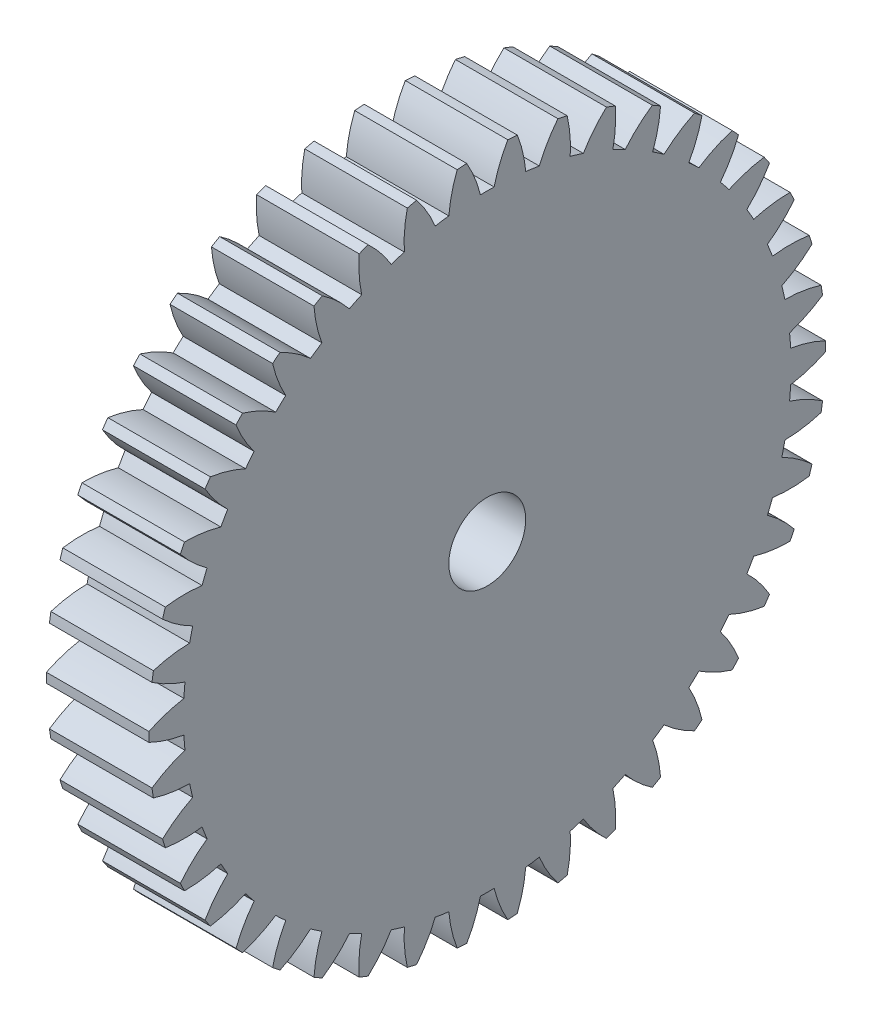
from build123d import *

# Parameters (mm, degrees)
BASPROSKE_W     = 4
BASPROSKE_H     = 13.2
TOOTHCUT_DEPTH  = 20.091359302
TEETHCUTS_COUNT = 42
TEETHCUTS_ANGLE = 351.428571429
BORSKE_R        = 1.5
BORE_DEPTH      = 50.0000508


with BuildPart() as part:
    # BasProSke → Base-Revolve (revolve)
    with BuildSketch(Plane(origin=(0, 0, 0), x_dir=(1, 0, 0), z_dir=(0, 1, 0)), mode=Mode.PRIVATE) as base_revolve_sk:
        with Locations((2, 6.6)):
            Rectangle(BASPROSKE_W, BASPROSKE_H)
    revolve(base_revolve_sk.sketch.rotate(Axis((-10, 0, 0), (1, 0, 0)), 180), axis=Axis((-10, 0, 0), (1, 0, 0)))

    # TooCutSke → ToothCut (cut, through all)
    with BuildSketch(Plane(origin=(0, 0, 0), x_dir=(0, 0, -1), z_dir=(1, 0, 0))):
        with BuildLine():
            ThreePointArc((0.267879645, 11.84597153), (0, 11.849), (-0.267879645, 11.84597153))
            ThreePointArc((-0.267879645, 11.84597153), (-0.492277047, 12.543046301), (-0.81532182, 13.200244524))
            ThreePointArc((-0.81532182, 13.200244524), (0, 13.2254), (0.81532182, 13.200244524))
            ThreePointArc((0.81532182, 13.200244524), (0.492277047, 12.543046301), (0.267879645, 11.84597153))
        make_face()
    toothcut = extrude(amount=TOOTHCUT_DEPTH, mode=Mode.SUBTRACT)

    # TeethCuts: ToothCut ×42 about axis
    teethcuts_axis = Axis((-10, 0, 0), (1, 0, 0))
    for i in range(1, TEETHCUTS_COUNT):
        add(toothcut.rotate(teethcuts_axis, i * TEETHCUTS_ANGLE / (TEETHCUTS_COUNT - 1)), mode=Mode.SUBTRACT)

    # BorSke → Bore (cut, symmetric)
    with BuildSketch(Plane(origin=(0, 0, 0), x_dir=(0, 0, -1), z_dir=(1, 0, 0))):
        with Locations(Location((0, 0, 0), (0, 0, 180))):
            Circle(BORSKE_R)
    extrude(amount=BORE_DEPTH, both=True, mode=Mode.SUBTRACT)


solid = part.part
